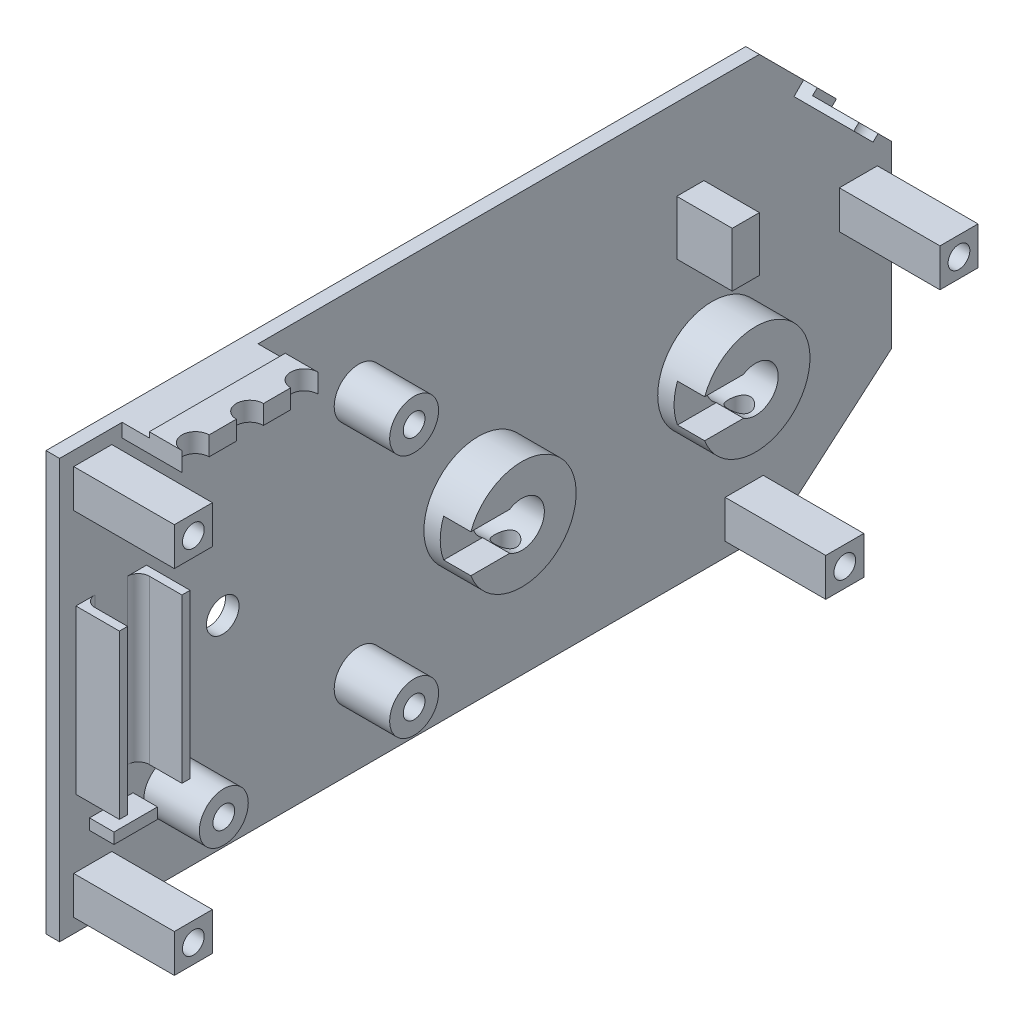
from build123d import *

# Parameters (mm, degrees)
BASE_DEPTH               = 2.5
SKETCH2_R                = 4.5
SKETCH2_R_2              = 2
SKETCH2_W                = 5
SKETCH2_H                = 10
PCB_MOUNT_DEPTH          = 10.2
BOSS_EXTRUDE14_REACH     = 178.254
BOSS_EXTRUDE14_START     = -4.5
SKETCH24_R               = 2
SKETCH3_R                = 10
SKETCH3_R_2              = 4.15
BOSS_EXTRUDE3_DEPTH      = 8
SKETCH4_W                = 7.770089688
SKETCH4_H                = 7
CUT_EXTRUDE1_DEPTH       = 5
SKETCH5_R                = 2
CUT_EXTRUDE2_DEPTH       = 160.985280573
SKETCH13_W               = 11
SKETCH13_H               = 25
BOSS_EXTRUDE8_DEPTH      = 2.5
BOSS_EXTRUDE9_DEPTH      = 1
BOSS_EXTRUDE9_DEPTH_BACK = 2.5
SKETCH15_W               = 6
SKETCH15_H               = 25
CUT_EXTRUDE4_REACH       = 174.265
SKETCH16_R               = 2.5
BOSS_EXTRUDE5_START      = -2.5
BOSS_EXTRUDE5_DEPTH      = 2.5
BOSS_EXTRUDE6_DEPTH      = 2.5
BOSS_EXTRUDE7_DEPTH      = 1.3
SKETCH19_W               = 1.5
SKETCH19_H               = 30
BOSS_EXTRUDE11_DEPTH     = 8
FILLET1_R                = 2
SKETCH20_W               = 8
SKETCH20_H               = 2
BOSS_EXTRUDE12_DEPTH     = 4.5
SKETCH21_W               = 7
SKETCH21_H               = 7
BOSS_EXTRUDE13_DEPTH     = 18.5
SKETCH22_R               = 2
CUT_EXTRUDE5_DEPTH       = 4.5
CUT_EXTRUDE6_REACH       = 175.014
SKETCH25_R               = 3


with BuildPart() as part:
    # Sketch1 → Base (new body)
    with BuildSketch(Plane(origin=(0, 0, 0), x_dir=(0, 0, -1), z_dir=(1, 0, 0))):
        Polygon((0, 0), (0, 77), (127, 77), (153, 51), (153, 18), (132, 0), align=None)
    extrude(amount=BASE_DEPTH)

    # Sketch2 → PCB_Mount (add)
    # profile 1 of 4: a face of its own
    with BuildSketch(Plane(origin=(2.5, 0, 0), x_dir=(0, 0, -1), z_dir=(1, 0, 0))):
        with Locations(Location((20, 15, 0), (0, 0, 180))):
            Circle(SKETCH2_R)
        with Locations((20, 15)):
            Circle(SKETCH2_R_2, mode=Mode.SUBTRACT)
    # profile 2 of 4: a face of its own
    with BuildSketch(Plane(origin=(2.5, 0, 0), x_dir=(0, 0, -1), z_dir=(1, 0, 0))):
        with Locations(Location((55, 15, 0), (0, 0, 180))):
            Circle(SKETCH2_R)
        with Locations((55, 15)):
            Circle(SKETCH2_R_2, mode=Mode.SUBTRACT)
    # profile 3 of 4: a face of its own
    with BuildSketch(Plane(origin=(2.5, 0, 0), x_dir=(0, 0, -1), z_dir=(1, 0, 0))):
        with Locations(Location((55, 60, 0), (0, 0, 180))):
            Circle(SKETCH2_R)
        with Locations((55, 60)):
            Circle(SKETCH2_R_2, mode=Mode.SUBTRACT)
    # profile 4 of 4: a face of its own
    with BuildSketch(Plane(origin=(2.5, 0, 0), x_dir=(0, 0, -1), z_dir=(1, 0, 0))):
        with Locations((116, 57)):
            Rectangle(SKETCH2_W, SKETCH2_H)
    extrude(amount=PCB_MOUNT_DEPTH)

    # Sketch24 → Boss-Extrude14 (add, up to next)
    with BuildSketch(Plane(origin=(12.7, 0, 0), x_dir=(0, 0, -1), z_dir=(1, 0, 0)).offset(BOSS_EXTRUDE14_START), mode=Mode.PRIVATE) as boss_extrude14_sk1:
        with Locations((55, 60)):
            Circle(SKETCH24_R)
    boss_extrude14_tool1 = extrude(boss_extrude14_sk1.sketch, amount=-BOSS_EXTRUDE14_REACH, mode=Mode.PRIVATE) - part.part
    # Sketch24 → Boss-Extrude14 (add, up to next)
    with BuildSketch(Plane(origin=(12.7, 0, 0), x_dir=(0, 0, -1), z_dir=(1, 0, 0)).offset(BOSS_EXTRUDE14_START), mode=Mode.PRIVATE) as boss_extrude14_sk2:
        with Locations((55, 15)):
            Circle(SKETCH24_R)
    boss_extrude14_tool2 = extrude(boss_extrude14_sk2.sketch, amount=-BOSS_EXTRUDE14_REACH, mode=Mode.PRIVATE) - part.part
    # Sketch24 → Boss-Extrude14 (add, up to next)
    with BuildSketch(Plane(origin=(12.7, 0, 0), x_dir=(0, 0, -1), z_dir=(1, 0, 0)).offset(BOSS_EXTRUDE14_START), mode=Mode.PRIVATE) as boss_extrude14_sk3:
        with Locations((20, 15)):
            Circle(SKETCH24_R)
    boss_extrude14_tool3 = extrude(boss_extrude14_sk3.sketch, amount=-BOSS_EXTRUDE14_REACH, mode=Mode.PRIVATE) - part.part
    add(boss_extrude14_tool1.solids().sort_by_distance((8.2, 60, -55))[0])
    add(boss_extrude14_tool2.solids().sort_by_distance((8.2, 15, -55))[0])
    add(boss_extrude14_tool3.solids().sort_by_distance((8.2, 15, -20))[0])

    # Sketch3 → Boss-Extrude3 (add)
    # profile 1 of 2: a face of its own
    with BuildSketch(Plane(origin=(2.5, 0, 0), x_dir=(0, 0, -1), z_dir=(1, 0, 0))):
        with Locations(Location((77, 32, 0), (0, 0, 180))):
            Circle(SKETCH3_R)
        with Locations((77, 32)):
            Circle(SKETCH3_R_2, mode=Mode.SUBTRACT)
    # profile 2 of 2: a face of its own
    with BuildSketch(Plane(origin=(2.5, 0, 0), x_dir=(0, 0, -1), z_dir=(1, 0, 0))):
        with Locations(Location((120, 32, 0), (0, 0, 180))):
            Circle(SKETCH3_R)
        with Locations((120, 32)):
            Circle(SKETCH3_R_2, mode=Mode.SUBTRACT)
    extrude(amount=BOSS_EXTRUDE3_DEPTH)

    # Sketch4 → Cut-Extrude1 (cut)
    with BuildSketch(Plane(origin=(10.5, 0, 0), x_dir=(0, 0, -1), z_dir=(1, 0, 0))):
        with Locations((70.885044844, 32)):
            Rectangle(SKETCH4_W, SKETCH4_H)
        with Locations((113.885044844, 32)):
            Rectangle(SKETCH4_W, SKETCH4_H)
    extrude(amount=-CUT_EXTRUDE1_DEPTH, mode=Mode.SUBTRACT)

    # Sketch5 → Cut-Extrude2 (cut, through all)
    with BuildSketch(Plane(origin=(0, 32, 0), x_dir=(1, 0, 0), z_dir=(0, 1, 0))):
        with Locations(Location((7.5, 77, 0), (0, 0, 270))):
            Circle(SKETCH5_R)
        with Locations(Location((7.5, 120, 0), (0, 0, 270))):
            Circle(SKETCH5_R)
    extrude(amount=-CUT_EXTRUDE2_DEPTH, mode=Mode.SUBTRACT)

    # Sketch13 → Boss-Extrude8 (add)
    with BuildSketch(Plane(origin=(0, 77, 0), x_dir=(1, 0, 0), z_dir=(0, 1, 0))):
        with Locations((8, 24)):
            Rectangle(SKETCH13_W, SKETCH13_H)
    extrude(amount=-BOSS_EXTRUDE8_DEPTH)

    # Sketch15 → Boss-Extrude9 (add, two sides: drawn at the far end of the back side and taken through both)
    with BuildSketch(Plane(origin=(0, 77, 0), x_dir=(1, 0, 0), z_dir=(0, 1, 0)).offset(-BOSS_EXTRUDE9_DEPTH_BACK)):
        with Locations((10.5, 24)):
            Rectangle(SKETCH15_W, SKETCH15_H)
    extrude(amount=BOSS_EXTRUDE9_DEPTH + BOSS_EXTRUDE9_DEPTH_BACK)

    # Sketch16 → Cut-Extrude4 (cut, up to next)
    with BuildSketch(Plane(origin=(0, 78, 0), x_dir=(1, 0, 0), z_dir=(0, 1, 0)), mode=Mode.PRIVATE) as cut_extrude4_sk1:
        with Locations((13.5, 24)):
            Circle(SKETCH16_R)
    cut_extrude4_tool1 = extrude(cut_extrude4_sk1.sketch, amount=-CUT_EXTRUDE4_REACH, mode=Mode.PRIVATE) & part.part
    # Sketch16 → Cut-Extrude4 (cut, up to next)
    with BuildSketch(Plane(origin=(0, 78, 0), x_dir=(1, 0, 0), z_dir=(0, 1, 0)), mode=Mode.PRIVATE) as cut_extrude4_sk2:
        with Locations((13.5, 34)):
            Circle(SKETCH16_R)
    cut_extrude4_tool2 = extrude(cut_extrude4_sk2.sketch, amount=-CUT_EXTRUDE4_REACH, mode=Mode.PRIVATE) & part.part
    # Sketch16 → Cut-Extrude4 (cut, up to next)
    with BuildSketch(Plane(origin=(0, 78, 0), x_dir=(1, 0, 0), z_dir=(0, 1, 0)), mode=Mode.PRIVATE) as cut_extrude4_sk3:
        with Locations((13.5, 14)):
            Circle(SKETCH16_R)
    cut_extrude4_tool3 = extrude(cut_extrude4_sk3.sketch, amount=-CUT_EXTRUDE4_REACH, mode=Mode.PRIVATE) & part.part
    add(cut_extrude4_tool1.solids().sort_by_distance((13.5, 78, -24))[0], mode=Mode.SUBTRACT)
    add(cut_extrude4_tool2.solids().sort_by_distance((13.5, 78, -34))[0], mode=Mode.SUBTRACT)
    add(cut_extrude4_tool3.solids().sort_by_distance((13.5, 78, -14))[0], mode=Mode.SUBTRACT)

    # Sketch9 → Boss-Extrude5 (add)
    with BuildSketch(Plane.ZY.offset(BOSS_EXTRUDE5_START)):
        Polygon((-127, 77), (-128.697056275, 77), (-140.364318164, 65.33273811), (-139.515790027, 64.484209973), align=None)
    extrude(amount=BOSS_EXTRUDE5_DEPTH)

    # Sketch10 → Boss-Extrude6 (add)
    with BuildSketch(Plane(origin=(2.5, 0, 0), x_dir=(0, 0, -1), z_dir=(1, 0, 0))):
        Polygon((140.364318164, 65.33273811), (136.828784258, 68.868272016), (135.061017306, 67.100505063), (138.596551211, 63.564971157), align=None)
    extrude(amount=BOSS_EXTRUDE6_DEPTH)

    # Sketch12 → Boss-Extrude7 (add)
    with BuildSketch(Plane(origin=(0, 101.080761184, -101.080761184), x_dir=(1, 0, 0), z_dir=(0, -0.7071067811865475, 0.7071067811865477))):
        with BuildLine():
            Line((5, -48.055339059), (5, -53.055339059))
            Line((5, -53.055339059), (13.5, -53.055339059))
            ThreePointArc((13.5, -53.055339059), (11, -50.555339059), (13.5, -48.055339059))
            Line((13.5, -48.055339059), (5, -48.055339059))
        make_face()
    extrude(amount=-BOSS_EXTRUDE7_DEPTH)

    # Sketch19 → Boss-Extrude11 (add)
    with BuildSketch(Plane(origin=(2.5, 0, 0), x_dir=(0, 0, -1), z_dir=(1, 0, 0))):
        with Locations((3.75, 37)):
            Rectangle(SKETCH19_W, SKETCH19_H)
        with Locations((15.25, 37)):
            Rectangle(SKETCH19_W, SKETCH19_H)
    extrude(amount=BOSS_EXTRUDE11_DEPTH)

    # Fillet1
    fillet1_edges = [part.edges().sort_by_distance(p)[0] for p in [
        (2.5, 37, -4.5),
        (2.5, 37, -14.5),
    ]]
    fillet(fillet1_edges, radius=FILLET1_R)

    # Sketch20 → Boss-Extrude12 (add)
    with BuildSketch(Plane(origin=(2.5, 0, 0), x_dir=(0, 0, -1), z_dir=(1, 0, 0))):
        with Locations((9.5, 16)):
            Rectangle(SKETCH20_W, SKETCH20_H)
    extrude(amount=BOSS_EXTRUDE12_DEPTH)

    # Sketch21 → Boss-Extrude13 (add)
    with BuildSketch(Plane(origin=(2.5, 0, 0), x_dir=(0, 0, -1), z_dir=(1, 0, 0))):
        with Locations((6.1, 70.9)):
            Rectangle(SKETCH21_W, SKETCH21_H)
        with Locations((6.1, 6.1)):
            Rectangle(SKETCH21_W, SKETCH21_H)
        with Locations((125.9, 6.1)):
            Rectangle(SKETCH21_W, SKETCH21_H)
        with Locations((146.9, 44.9)):
            Rectangle(SKETCH21_W, SKETCH21_H)
    extrude(amount=BOSS_EXTRUDE13_DEPTH)

    # Sketch22 → Cut-Extrude5 (cut)
    with BuildSketch(Plane(origin=(21, 0, 0), x_dir=(0, 0, -1), z_dir=(1, 0, 0))):
        with Locations((6.1, 6.1)):
            Circle(SKETCH22_R)
        with Locations((6.1, 70.9)):
            Circle(SKETCH22_R)
        with Locations((146.9, 44.9)):
            Circle(SKETCH22_R)
        with Locations((125.9, 6.1)):
            Circle(SKETCH22_R)
    extrude(amount=-CUT_EXTRUDE5_DEPTH, mode=Mode.SUBTRACT)

    # Sketch25 → Cut-Extrude6 (cut, up to next)
    with BuildSketch(Plane.ZY, mode=Mode.PRIVATE) as cut_extrude6_sk1:
        with Locations((-30, 37)):
            Circle(SKETCH25_R)
    cut_extrude6_tool1 = extrude(cut_extrude6_sk1.sketch, amount=-CUT_EXTRUDE6_REACH, mode=Mode.PRIVATE) & part.part
    add(cut_extrude6_tool1.solids().sort_by_distance((0, 37, -30))[0], mode=Mode.SUBTRACT)


solid = part.part
